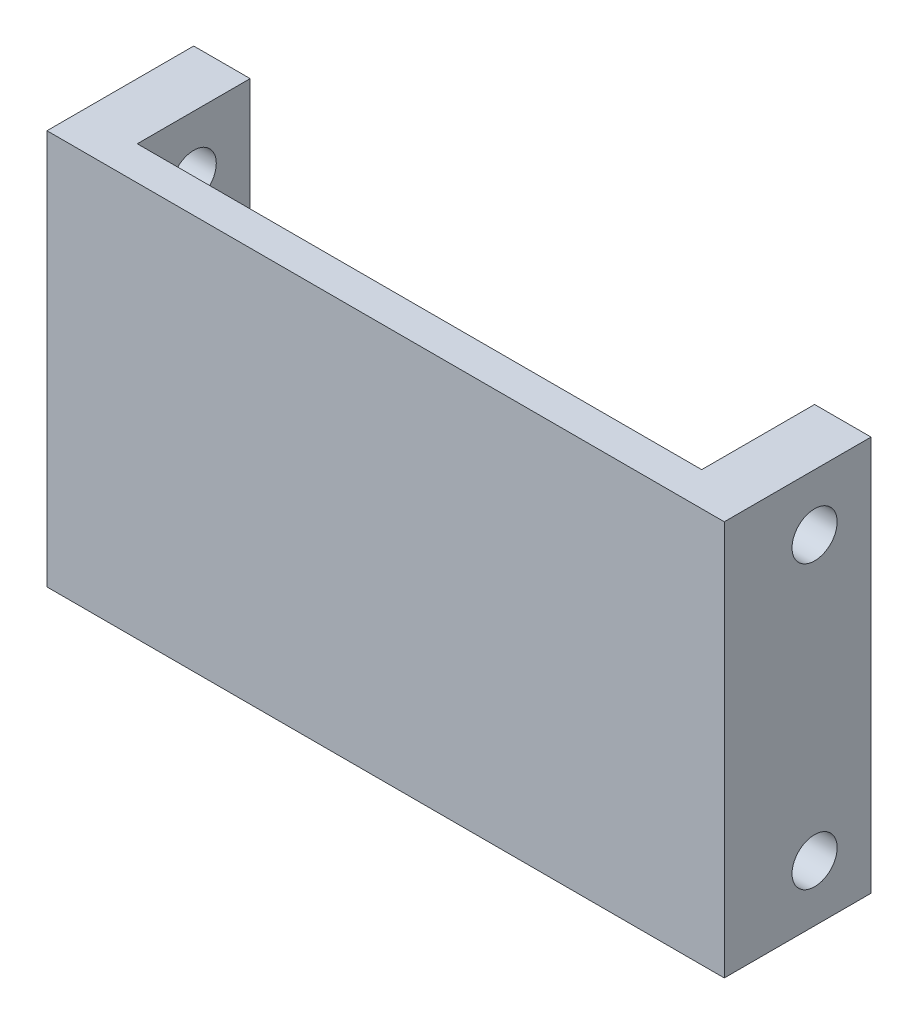
from build123d import *

# Parameters (mm, degrees)
SKETCH2_W           = 60
SKETCH2_H           = 35
BOSS_EXTRUDE1_DEPTH = 3
SKETCH3_W           = 5
SKETCH3_H           = 35
BOSS_EXTRUDE2_DEPTH = 10
SKETCH4_R           = 2
CUT_EXTRUDE1_DEPTH  = 64.294944506


with BuildPart() as part:
    # Sketch2 → Boss-Extrude1 (new body)
    with BuildSketch(Plane.XY):
        Rectangle(SKETCH2_W, SKETCH2_H)
    extrude(amount=BOSS_EXTRUDE1_DEPTH)

    # Sketch3 → Boss-Extrude2 (add)
    with BuildSketch(Plane(origin=(0, 0, 0), x_dir=(-1, 0, 0), z_dir=(0, 0, -1))):
        with Locations((-27.5, 0)):
            Rectangle(SKETCH3_W, SKETCH3_H)
        with Locations((27.5, 0)):
            Rectangle(SKETCH3_W, SKETCH3_H)
    extrude(amount=BOSS_EXTRUDE2_DEPTH)

    # Sketch4 → Cut-Extrude1 (cut, through all)
    with BuildSketch(Plane(origin=(30, 0, 0), x_dir=(0, 0, -1), z_dir=(1, 0, 0))):
        with Locations((5, 12.5)):
            Circle(SKETCH4_R)
        with Locations((5, -12.5)):
            Circle(SKETCH4_R)
    extrude(amount=-CUT_EXTRUDE1_DEPTH, mode=Mode.SUBTRACT)


solid = part.part
